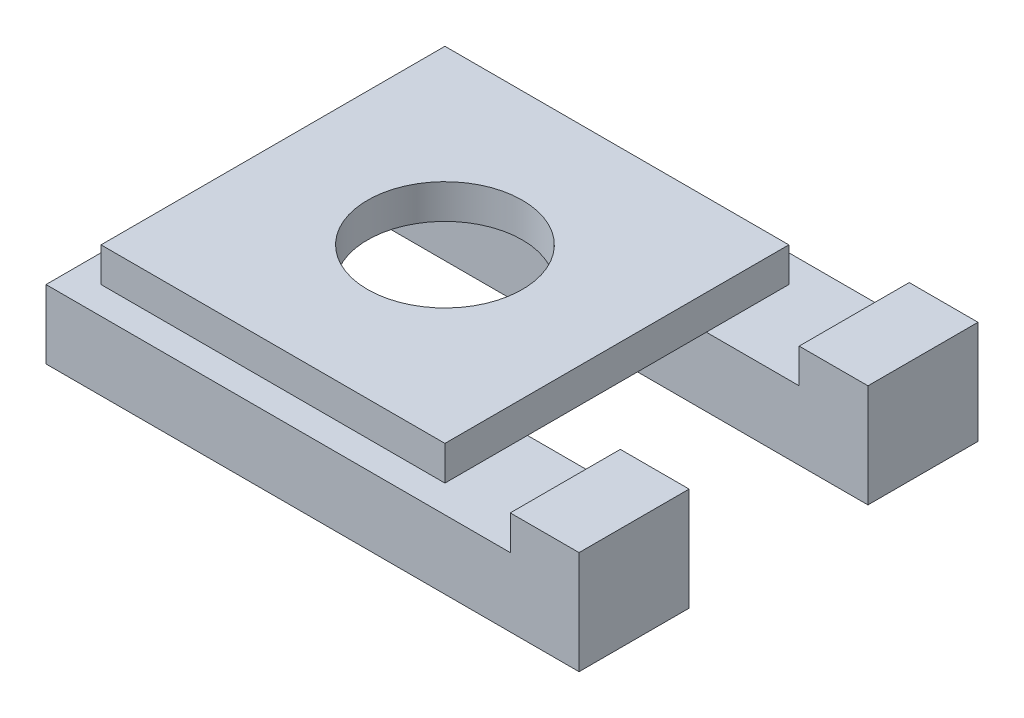
from build123d import *

# Parameters (mm, degrees)
SKETCH1_W           = 20
SKETCH1_H           = 32
SKETCH1_W_2         = 100
SKETCH1_H_2         = 24
BOSS_EXTRUDE1_DEPTH = 20
BOSS_EXTRUDE2_START = 20
SKETCH1_3_W         = 20
SKETCH1_3_H         = 32
BOSS_EXTRUDE2_DEPTH = 10
BOSS_EXTRUDE3_START = 20
SKETCH1_5_W         = 100
SKETCH1_5_H         = 24
SKETCH1_5_H_2       = 52
SKETCH1_5_R         = 22.5
BOSS_EXTRUDE3_DEPTH = 10


with BuildPart() as part:
    # Sketch1 → Boss-Extrude1 (new body)
    with BuildSketch(Plane(origin=(0, 0, 0), x_dir=(1, 0, 0), z_dir=(0, 1, 0))):
        Polygon((50, -50), (-50, -50), (-50, -26), (-58, -26), (-58, -58), (77, -58), (77, -26), (50, -26), align=None)
        Polygon((-58, 26), (-50, 26), (-50, 50), (50, 50), (50, 26), (77, 26), (77, 58), (-58, 58), align=None)
        with Locations((87, -42)):
            Rectangle(SKETCH1_W, SKETCH1_H)
        with Locations((87, 42)):
            Rectangle(SKETCH1_W, SKETCH1_H)
        with Locations((0, -38)):
            Rectangle(SKETCH1_W_2, SKETCH1_H_2)
        with Locations((0, 38)):
            Rectangle(SKETCH1_W_2, SKETCH1_H_2)
    extrude(amount=BOSS_EXTRUDE1_DEPTH)

    # Sketch1<3> → Boss-Extrude2 (add)
    with BuildSketch(Plane(origin=(0, 0, 0), x_dir=(1, 0, 0), z_dir=(0, 1, 0)).offset(BOSS_EXTRUDE2_START)):
        with Locations((87, -42)):
            Rectangle(SKETCH1_3_W, SKETCH1_3_H)
        with Locations((87, 42)):
            Rectangle(SKETCH1_3_W, SKETCH1_3_H)
    extrude(amount=BOSS_EXTRUDE2_DEPTH)

    # Sketch1<5> → Boss-Extrude3 (add)
    # profile 1 of 3: a face of its own
    with BuildSketch(Plane(origin=(0, 0, 0), x_dir=(1, 0, 0), z_dir=(0, 1, 0)).offset(BOSS_EXTRUDE3_START)):
        with Locations((0, -38)):
            Rectangle(SKETCH1_5_W, SKETCH1_5_H)
    # profile 2 of 3: a face of its own
    with BuildSketch(Plane(origin=(0, 0, 0), x_dir=(1, 0, 0), z_dir=(0, 1, 0)).offset(BOSS_EXTRUDE3_START)):
        Rectangle(SKETCH1_5_W, SKETCH1_5_H_2)
        with Locations(Location((0, 0, 0), (0, 0, 270))):
            Circle(SKETCH1_5_R, mode=Mode.SUBTRACT)
    # profile 3 of 3: a face of its own
    with BuildSketch(Plane(origin=(0, 0, 0), x_dir=(1, 0, 0), z_dir=(0, 1, 0)).offset(BOSS_EXTRUDE3_START)):
        with Locations((0, 38)):
            Rectangle(SKETCH1_5_W, SKETCH1_5_H)
    extrude(amount=BOSS_EXTRUDE3_DEPTH)


solid = part.part
